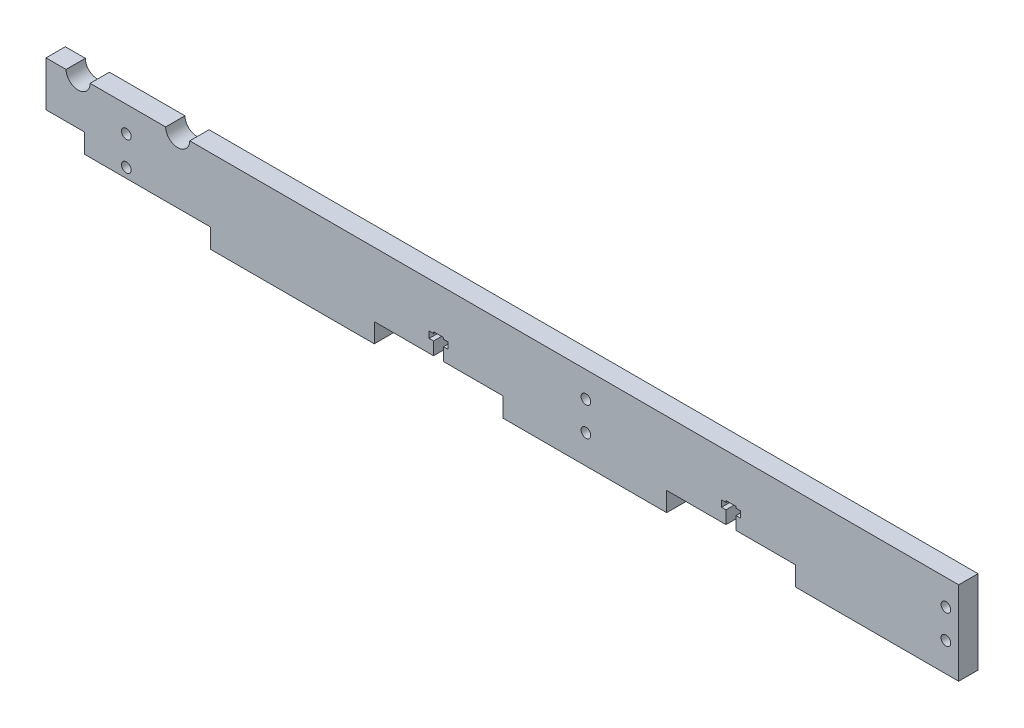
from build123d import *

# Parameters (mm, degrees)
SZKIC1_W                    = 284
SZKIC1_H                    = 26
DODANIE_WYCI_GNI_CIE1_DEPTH = 6
SZKIC5_W                    = 40
SZKIC5_H                    = 6
WYTNIJ_WYCI_GNI_CIE3_DEPTH  = 6
SZYK_LINIOWY1_COUNT         = 4
SZYK_LINIOWY1_PITCH         = 91
WYTNIJ_WYCI_GNI_CIE4_DEPTH  = 6
SZYK_LINIOWY2_COUNT         = 2
SZYK_LINIOWY2_PITCH         = 91
SZKIC9_W                    = 12
SZKIC9_H                    = 12
WYTNIJ_WYCI_GNI_CIE6_DEPTH  = 10
SZKIC10_R                   = 1.5
WYTNIJ_WYCI_GNI_CIE7_DEPTH  = 10
SZKIC12_R                   = 3.75
WYTNIJ_WYCI_GNI_CIE8_DEPTH  = 6


with BuildPart() as part:
    # Szkic1 → Dodanie-wyciągnięcie1 (new body)
    with BuildSketch(Plane.XY):
        with Locations((-737.9, 7)):
            Rectangle(SZKIC1_W, SZKIC1_H)
    extrude(amount=-DODANIE_WYCI_GNI_CIE1_DEPTH)

    # Szkic5 → Wytnij-wyciągnięcie3 (cut)
    with BuildSketch(Plane.XY):
        with Locations((-666.76, -3)):
            Rectangle(SZKIC5_W, SZKIC5_H)
    wytnij_wyci_gni_cie3 = extrude(amount=-WYTNIJ_WYCI_GNI_CIE3_DEPTH, mode=Mode.SUBTRACT)

    # Szyk liniowy1: Wytnij-wyciągnięcie3 ×4
    with Locations(*[(-i * SZYK_LINIOWY1_PITCH, 0, 0) for i in range(1, SZYK_LINIOWY1_COUNT)]):
        add(wytnij_wyci_gni_cie3, mode=Mode.SUBTRACT)

    # Szkic6 → Wytnij-wyciągnięcie4 (cut)
    with BuildSketch(Plane.XY):
        Polygon((-665.21, 0), (-668.31, 0), (-668.31, 4), (-669.685, 4), (-669.685, 6), (-668.31, 6), (-668.31, 6.5), (-665.21, 6.5), (-665.21, 6), (-663.835, 6), (-663.835, 4), (-665.21, 4), align=None)
    wytnij_wyci_gni_cie4 = extrude(amount=-WYTNIJ_WYCI_GNI_CIE4_DEPTH, mode=Mode.SUBTRACT)

    # Szyk liniowy2: Wytnij-wyciągnięcie4 ×2
    with Locations(*[(-i * SZYK_LINIOWY2_PITCH, 0, 0) for i in range(1, SZYK_LINIOWY2_COUNT)]):
        add(wytnij_wyci_gni_cie4, mode=Mode.SUBTRACT)

    # Szkic9 → Wytnij-wyciągnięcie6 (cut)
    with BuildSketch(Plane.XY):
        with Locations((-873.9, 0)):
            Rectangle(SZKIC9_W, SZKIC9_H)
    extrude(amount=-WYTNIJ_WYCI_GNI_CIE6_DEPTH, mode=Mode.SUBTRACT)

    # Szkic10 → Wytnij-wyciągnięcie7 (cut)
    with BuildSketch(Plane.XY):
        with Locations((-599.9, 3)):
            Circle(SZKIC10_R)
        with Locations((-599.9, 12)):
            Circle(SZKIC10_R)
        with Locations((-854.9, 3)):
            Circle(SZKIC10_R)
        with Locations((-854.9, 12)):
            Circle(SZKIC10_R)
        with Locations((-711.9, 3)):
            Circle(SZKIC10_R)
        with Locations((-711.9, 12)):
            Circle(SZKIC10_R)
    extrude(amount=-WYTNIJ_WYCI_GNI_CIE7_DEPTH, mode=Mode.SUBTRACT)

    # Szkic12 → Wytnij-wyciągnięcie8 (cut)
    with BuildSketch(Plane.XY):
        with Locations((-838.918997424, 20.044165404)):
            Circle(SZKIC12_R)
        with Locations((-869.918997424, 20.044165404)):
            Circle(SZKIC12_R)
    extrude(amount=-WYTNIJ_WYCI_GNI_CIE8_DEPTH, mode=Mode.SUBTRACT)


solid = part.part
